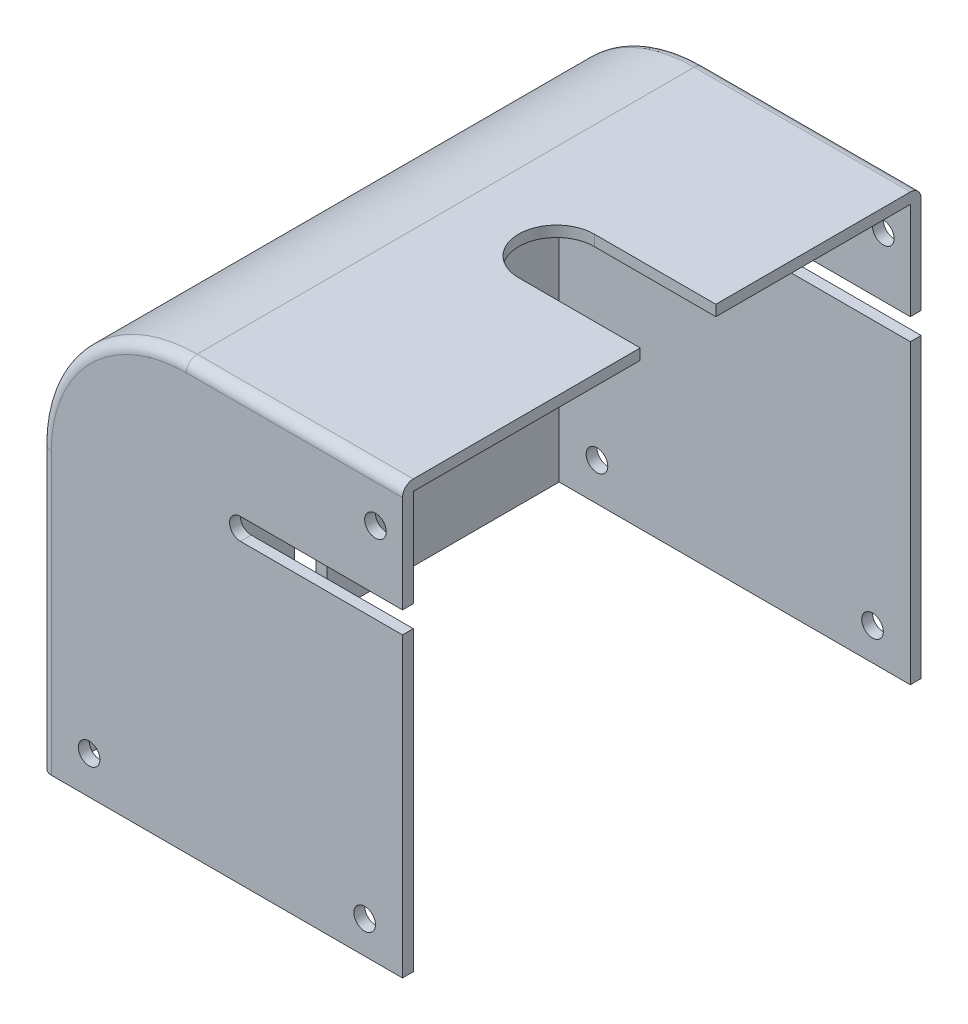
from build123d import *

# Parameters (mm, degrees)
BOSS_EXTRUDE1_DEPTH = 46
BOSS_EXTRUDE2_START = 2
BOSS_EXTRUDE2_DEPTH = 2
FILLET1_R           = 2
CUT_EXTRUDE1_DEPTH  = 5
CUT_EXTRUDE2_DEPTH  = 141.121375957
CUT_EXTRUDE3_DEPTH  = 115.166545012
SKETCH6_R           = 2
CUT_EXTRUDE4_DEPTH  = 141.121375957


with BuildPart() as part:
    # Sketch1 → Boss-Extrude1 (new, symmetric)
    with BuildSketch(Plane.XY):
        with BuildLine():
            Line((0, 0), (-40, 0))
            ThreePointArc((-40, 0), (-57.67766953, -7.32233047), (-65, -25))
            Line((-65, -25), (-65, -77))
            Line((-65, -77), (-67, -77))
            Line((-67, -77), (-67, -25))
            ThreePointArc((-67, -25), (-59.091883092, -5.908116908), (-40, 2))
            Line((-40, 2), (0, 2))
            Line((0, 2), (0, 0))
        make_face()
    extrude(amount=BOSS_EXTRUDE1_DEPTH, both=True)

    # Sketch2 → Boss-Extrude2 (add)
    with BuildSketch(Plane.XY.offset(46).offset(BOSS_EXTRUDE2_START)):
        with BuildLine():
            Line((-67, -25), (-67, -77))
            Line((-67, -77), (0, -77))
            Line((0, -77), (0, 2))
            Line((0, 2), (-40, 2))
            ThreePointArc((-40, 2), (-59.091883092, -5.908116908), (-67, -25))
        make_face()
    boss_extrude2 = extrude(amount=-BOSS_EXTRUDE2_DEPTH)

    # Mirror1: Boss-Extrude2 across plane
    add(boss_extrude2.mirror(Plane.XY))

    # Fillet1
    fillet1_edges = [part.edges().sort_by_distance(p)[0] for p in [
        (-59.091883092, -5.908116908, 48),
        (-67, -51, 48),
        (-20, 2, 48),
        (-59.091883092, -5.908116908, -48),
        (-20, 2, -48),
        (-67, -51, -48),
    ]]
    fillet(fillet1_edges, radius=FILLET1_R)

    # Sketch3 → Cut-Extrude1 (cut)
    with BuildSketch(Plane.ZY.offset(67)):
        with BuildLine():
            Line((-3, -77), (-3, -47))
            ThreePointArc((-3, -47), (0, -44), (3, -47))
            Line((3, -47), (3, -77))
            ThreePointArc((3, -77), (0, -80), (-3, -77))
        make_face()
    extrude(amount=-CUT_EXTRUDE1_DEPTH, mode=Mode.SUBTRACT)

    # Sketch4 → Cut-Extrude2 (cut, through all)
    with BuildSketch(Plane.XY.offset(48)):
        with BuildLine():
            Line((0, -22), (-30, -22))
            ThreePointArc((-30, -22), (-32, -20), (-30, -18))
            Line((-30, -18), (0, -18))
            ThreePointArc((0, -18), (2, -20), (0, -22))
        make_face()
    extrude(amount=-CUT_EXTRUDE2_DEPTH, mode=Mode.SUBTRACT)

    # Sketch5 → Cut-Extrude3 (cut, through all)
    with BuildSketch(Plane(origin=(0, 2, 0), x_dir=(1, 0, 0), z_dir=(0, 1, 0))):
        with BuildLine():
            Line((0, -4), (-22.5, -4))
            ThreePointArc((-22.5, -4), (-29.5, 3), (-22.5, 10))
            Line((-22.5, 10), (0, 10))
            ThreePointArc((0, 10), (7, 3), (0, -4))
        make_face()
    extrude(amount=-CUT_EXTRUDE3_DEPTH, mode=Mode.SUBTRACT)

    # Sketch6 → Cut-Extrude4 (cut, through all)
    with BuildSketch(Plane.XY.offset(48)):
        with Locations((-5, -7)):
            Circle(SKETCH6_R)
        with Locations((-7, -71)):
            Circle(SKETCH6_R)
        with Locations((-58, -70)):
            Circle(SKETCH6_R)
    extrude(amount=-CUT_EXTRUDE4_DEPTH, mode=Mode.SUBTRACT)


solid = part.part
